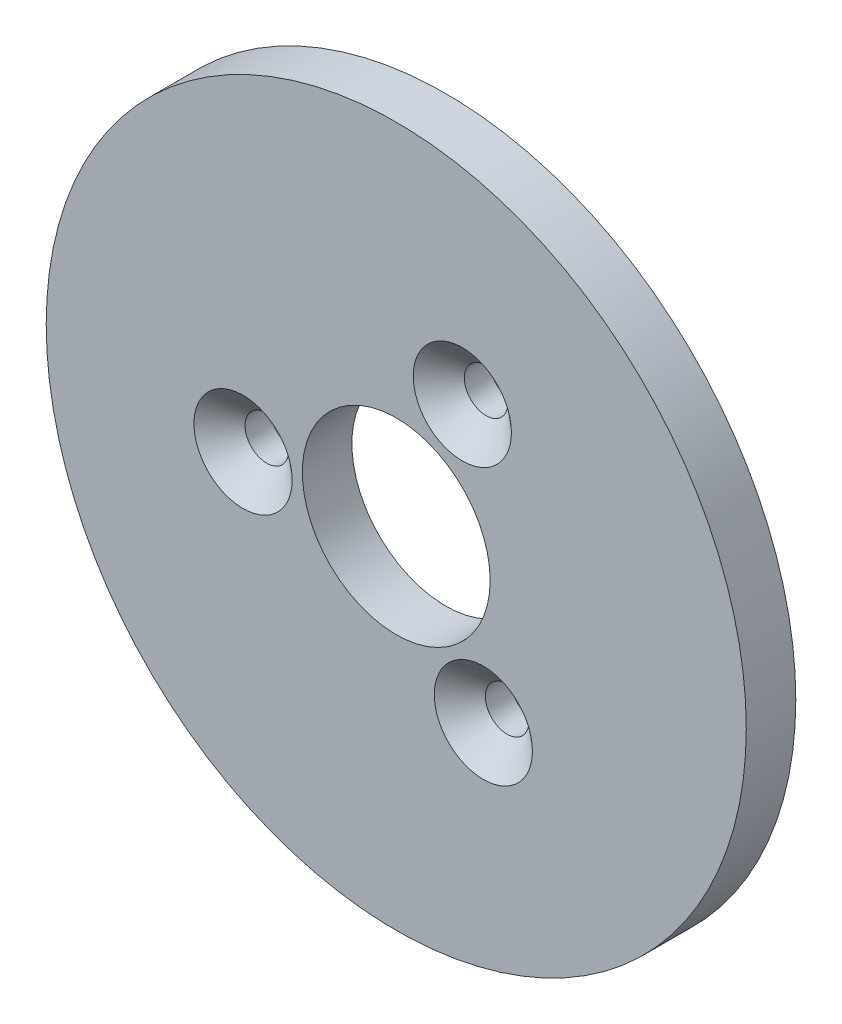
from build123d import *

# Parameters (mm, degrees)
SKETCH1_R           = 20.5
BOSS_EXTRUDE1_DEPTH = 2.9
SKETCH2_R           = 1.275
CUT_EXTRUDE1_DEPTH  = 30.136060132
CHAMFER1_SIZE       = 1.6
CHAMFER1_SIZE2      = 1.390858781
SKETCH3_R           = 5.5
CUT_EXTRUDE2_DEPTH  = 30.136060132


with BuildPart() as part:
    # Sketch1 → Boss-Extrude1 (new body)
    with BuildSketch(Plane.XY):
        Circle(SKETCH1_R)
    extrude(amount=BOSS_EXTRUDE1_DEPTH)

    # Sketch2 → Cut-Extrude1 (cut, through all)
    with BuildSketch(Plane.XY.offset(2.9)):
        with Locations((-8.971859678, -0.711149714)):
            Circle(SKETCH2_R)
        with Locations((5.101803557, -7.414283544)):
            Circle(SKETCH2_R)
        with Locations((3.870056121, 8.125433257)):
            Circle(SKETCH2_R)
    extrude(amount=-CUT_EXTRUDE1_DEPTH, mode=Mode.SUBTRACT)

    # Chamfer1
    chamfer1_edges = [part.edges().sort_by_distance(p)[0] for p in [
        (3.826803557, -7.414283544, 2.9),
        (2.595056121, 8.125433257, 2.9),
        (-10.246859678, -0.711149714, 2.9),
    ]]
    chamfer1_side = [part.faces().sort_by_distance(p)[0] for p in [
        (0, 0, 2.9),
    ]]
    chamfer(chamfer1_edges, length=CHAMFER1_SIZE, length2=CHAMFER1_SIZE2, reference=chamfer1_side[0])

    # Sketch3 → Cut-Extrude2 (cut, through all)
    with BuildSketch(Plane.XY.offset(2.9)):
        Circle(SKETCH3_R)
    extrude(amount=-CUT_EXTRUDE2_DEPTH, mode=Mode.SUBTRACT)


solid = part.part
